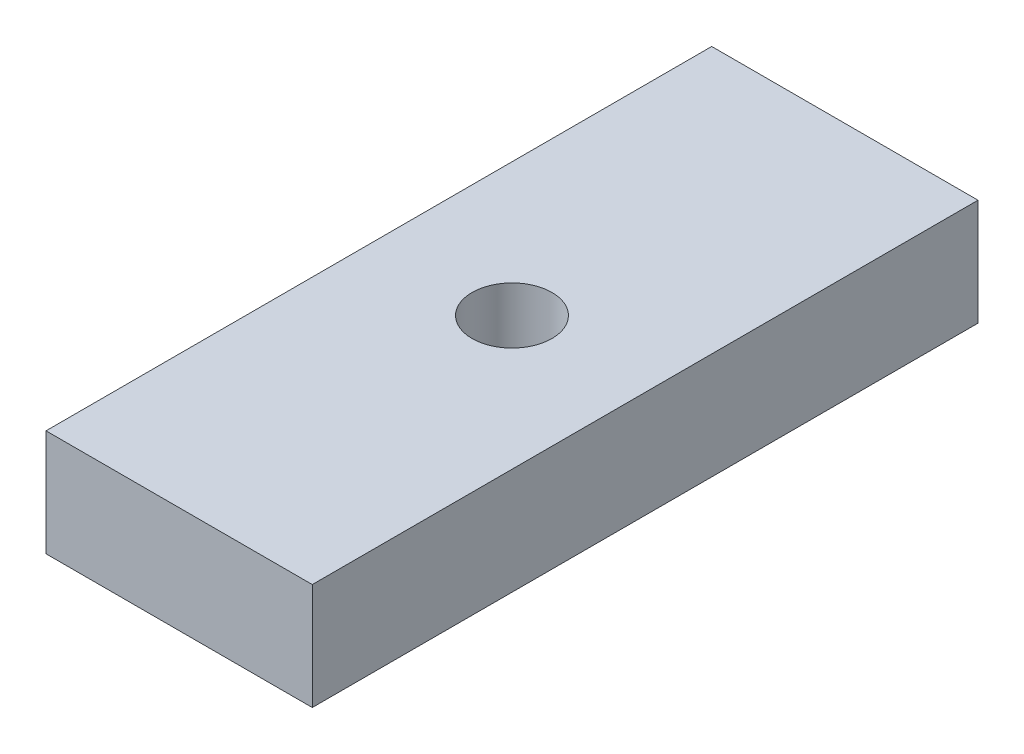
from build123d import *

# Parameters (mm, degrees)
SKETCH2_W                    = 25
SKETCH2_H                    = 4
PROFILEBOSS_EXTRUDE1_DEPTH   = 10
MOUNTHOLESSKETCH5_R          = 1.5
MOUNTHOLESCUT_EXTRUDE2_DEPTH = 28.221315178


with BuildPart() as part:
    # Sketch2 → ProfileBoss-Extrude1 (new body)
    with BuildSketch(Plane(origin=(0, 0, 0), x_dir=(0, 0, -1), z_dir=(1, 0, 0))):
        with Locations((12.5, 2)):
            Rectangle(SKETCH2_W, SKETCH2_H)
    extrude(amount=PROFILEBOSS_EXTRUDE1_DEPTH)

    # MountHolesSketch5 → MountHolesCut-Extrude2 (cut, through all)
    with BuildSketch(Plane(origin=(0, 4, 0), x_dir=(1, 0, 0), z_dir=(0, 1, 0))):
        with Locations(Location((5, 12.5, 0), (0, 0, 270))):
            Circle(MOUNTHOLESSKETCH5_R)
    extrude(amount=-MOUNTHOLESCUT_EXTRUDE2_DEPTH, mode=Mode.SUBTRACT)


solid = part.part
